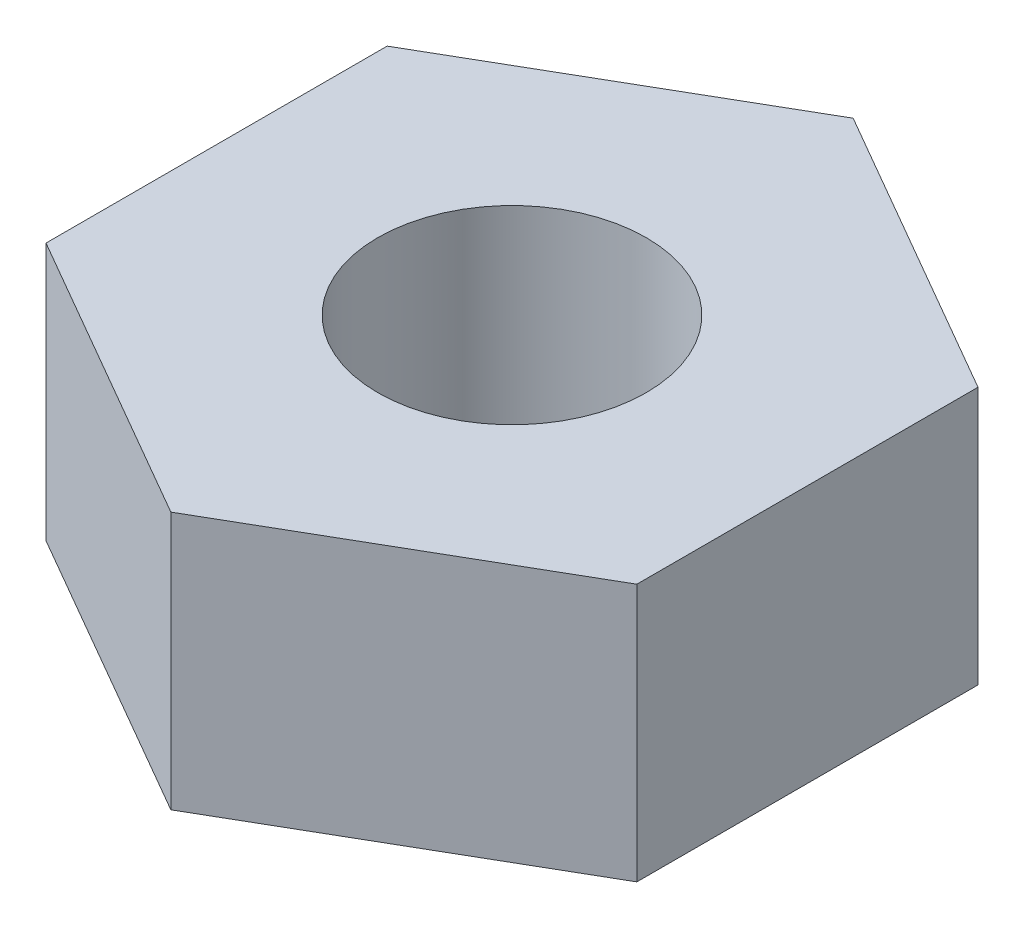
from build123d import *

# Parameters (mm, degrees)
EXTRUDE_1_DEPTH    = 2.4
HOLE_WIZARD_M3_1_D = 2.5


with BuildPart() as part:
    # 草图1 → 凸台-拉伸1 (new body)
    with BuildSketch(Plane(origin=(0, 0, 0), x_dir=(1, 0, 0), z_dir=(0, 1, 0))):
        Polygon((2.75, -1.58771324), (2.75, 1.58771324), (0, 3.175426481), (-2.75, 1.58771324), (-2.75, -1.58771324), (0, -3.175426481), align=None)
    extrude(amount=EXTRUDE_1_DEPTH)

    # M3 螺纹孔1 (through all)
    with Locations(Plane(origin=(0, 0, 0), x_dir=(0, 0, -1), z_dir=(0, -1, 0))):
        with Locations((0, 0)):
            Hole(HOLE_WIZARD_M3_1_D / 2)


solid = part.part
